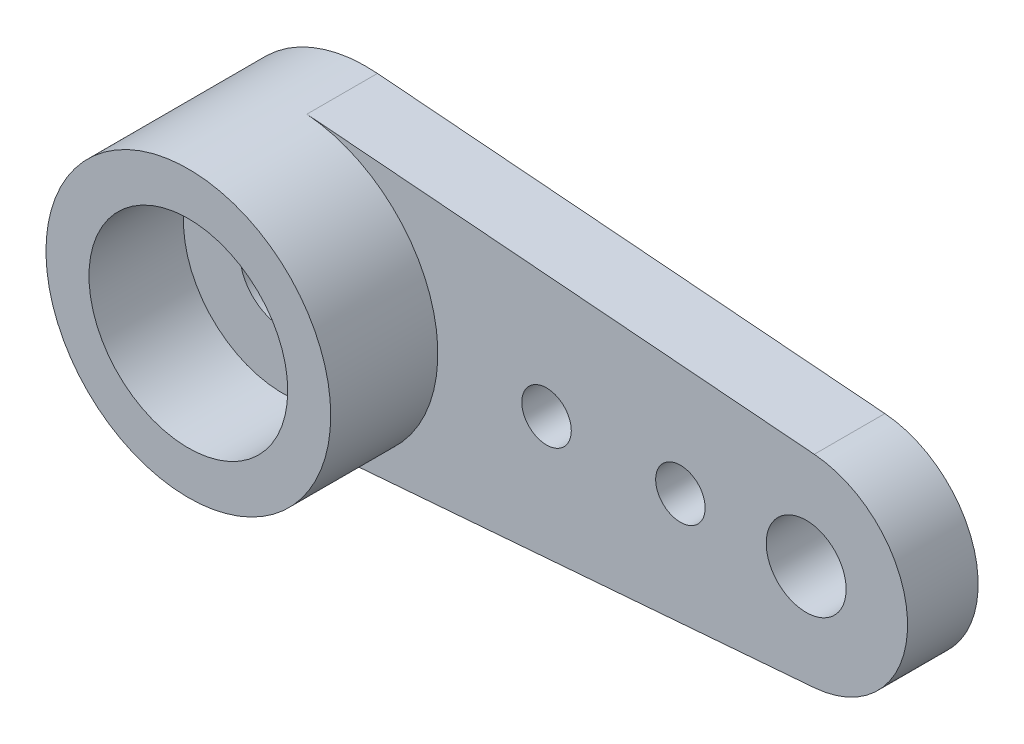
from build123d import *

# Parameters (mm, degrees)
SCHIZZO1_R                   = 0.61
SCHIZZO1_R_2                 = 0.985
ESTRUSIONE_ESTRUSIONE1_DEPTH = 1.74
ESTRUSIONE_ESTRUSIONE2_START = -1.74
SCHIZZO2_R                   = 3.51
ESTRUSIONE_ESTRUSIONE2_DEPTH = 4.38
ESTRUSIONE_ESTRUSIONE3_START = -4.38
SCHIZZO3_R                   = 2.7
ESTRUSIONE_ESTRUSIONE3_DEPTH = 5.05
SCHIZZO4_R                   = 2.45
TAGLIO_ESTRUSIONE1_DEPTH     = 2.33
SCHIZZO5_R                   = 2
TAGLIO_ESTRUSIONE2_DEPTH     = 1.35
TAGLIO_ESTRUSIONE3_REACH     = 17.929
SCHIZZO6_R                   = 1.06


with BuildPart() as part:
    # Schizzo1 → Estrusione-Estrusione1 (new body)
    with BuildSketch(Plane.XY):
        with BuildLine():
            Line((12.790555997, 2.491942474), (0.28158062, 3.498687233))
            ThreePointArc((0.28158062, 3.498687233), (-3.51, 0), (0.28158062, -3.498687233))
            Line((0.28158062, -3.498687233), (12.790555997, -2.491942474))
            ThreePointArc((12.790555997, -2.491942474), (15.09, 0), (12.790555997, 2.491942474))
        make_face()
        with Locations((9.49, 0)):
            Circle(SCHIZZO1_R, mode=Mode.SUBTRACT)
        with Locations((6.19, 0)):
            Circle(SCHIZZO1_R, mode=Mode.SUBTRACT)
        with Locations((12.59, 0)):
            Circle(SCHIZZO1_R_2, mode=Mode.SUBTRACT)
    extrude(amount=ESTRUSIONE_ESTRUSIONE1_DEPTH)

    # Schizzo2 → Estrusione-Estrusione2 (add)
    with BuildSketch(Plane.XY.offset(1.74).offset(ESTRUSIONE_ESTRUSIONE2_START)):
        with Locations(Location((0, 0, 0), (0, 0, 274.601349332))):
            Circle(SCHIZZO2_R)
    extrude(amount=ESTRUSIONE_ESTRUSIONE2_DEPTH)

    # Schizzo3 → Estrusione-Estrusione3 (add)
    with BuildSketch(Plane(origin=(0, 0, 0), x_dir=(-1, 0, 0), z_dir=(0, 0, -1)).offset(ESTRUSIONE_ESTRUSIONE3_START)):
        with Locations(Location((0, 0, 0), (0, 0, 180))):
            Circle(SCHIZZO3_R)
    extrude(amount=ESTRUSIONE_ESTRUSIONE3_DEPTH)

    # Schizzo4 → Taglio-Estrusione1 (cut)
    with BuildSketch(Plane.XY.offset(4.38)):
        Circle(SCHIZZO4_R)
    extrude(amount=-TAGLIO_ESTRUSIONE1_DEPTH, mode=Mode.SUBTRACT)

    # Schizzo5 → Taglio-Estrusione2 (cut)
    with BuildSketch(Plane(origin=(0, 0, -0.67), x_dir=(-1, 0, 0), z_dir=(0, 0, -1))):
        Circle(SCHIZZO5_R)
    extrude(amount=-TAGLIO_ESTRUSIONE2_DEPTH, mode=Mode.SUBTRACT)

    # Schizzo6 → Taglio-Estrusione3 (cut, up to next)
    with BuildSketch(Plane(origin=(0, 0, 0.68), x_dir=(-1, 0, 0), z_dir=(0, 0, -1)), mode=Mode.PRIVATE) as taglio_estrusione3_sk1:
        Circle(SCHIZZO6_R)
    taglio_estrusione3_tool1 = extrude(taglio_estrusione3_sk1.sketch, amount=-TAGLIO_ESTRUSIONE3_REACH, mode=Mode.PRIVATE) & part.part
    add(taglio_estrusione3_tool1.solids().sort_by_distance((0, 0, 0.68))[0], mode=Mode.SUBTRACT)


solid = part.part
